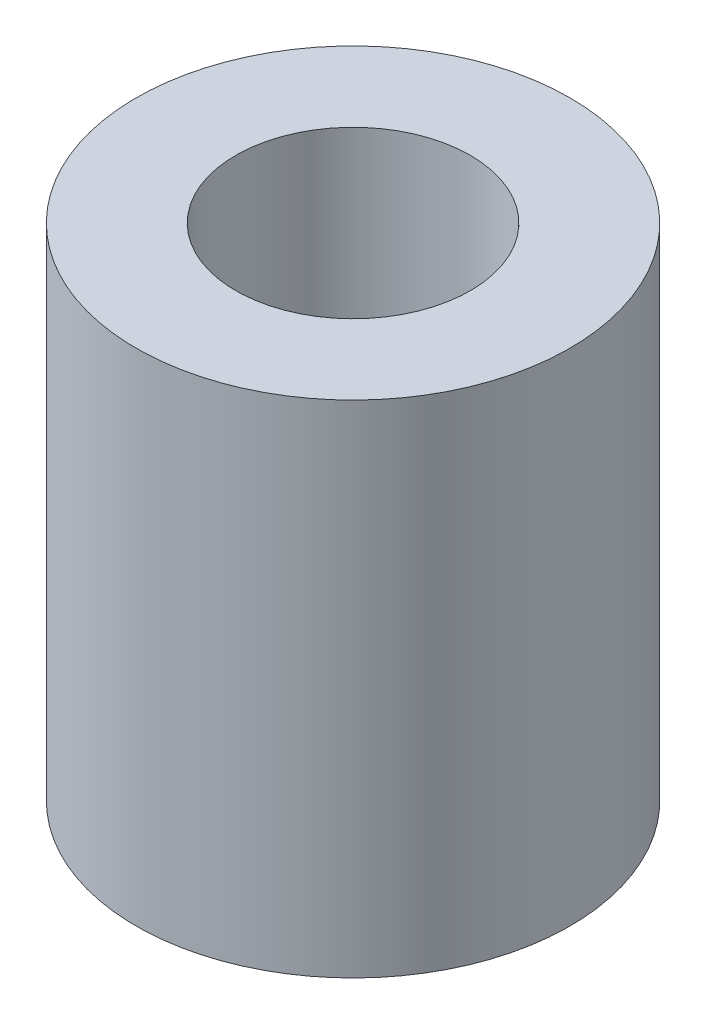
from build123d import *

# Parameters (mm, degrees)
CUT_EXTRUDE1_REACH = 46.685
SKETCH2_R          = 7.366


with BuildPart() as part:
    # Sketch1 → Revolve1 (revolve)
    with BuildSketch(Plane(origin=(0, 0, 0), x_dir=(0, 0, -1), z_dir=(1, 0, 0)), mode=Mode.PRIVATE) as revolve1_sk:
        Polygon((0, 0), (-16.51, 0), (-16.51, 38.1), (-8.9281, 38.1), (-8.9281, 20.32), (-10.795, 20.32), (-10.795, 2.54), (-8.9281, 2.54), (0, 2.54), align=None)
    revolve(revolve1_sk.sketch.rotate(Axis((0, 0, 0), (0, 1, 0)), 180), axis=Axis((0, 0, 0), (0, 1, 0)))

    # Sketch2 → Cut-Extrude1 (cut, up to next)
    with BuildSketch(Plane.XZ, mode=Mode.PRIVATE) as cut_extrude1_sk1:
        with Locations(Location((0, 0, 0), (0, 0, 270))):
            Circle(SKETCH2_R)
    cut_extrude1_tool1 = extrude(cut_extrude1_sk1.sketch, amount=-CUT_EXTRUDE1_REACH, mode=Mode.PRIVATE) & part.part
    add(cut_extrude1_tool1.solids().sort_by_distance((0, 0, 0))[0], mode=Mode.SUBTRACT)


solid = part.part
